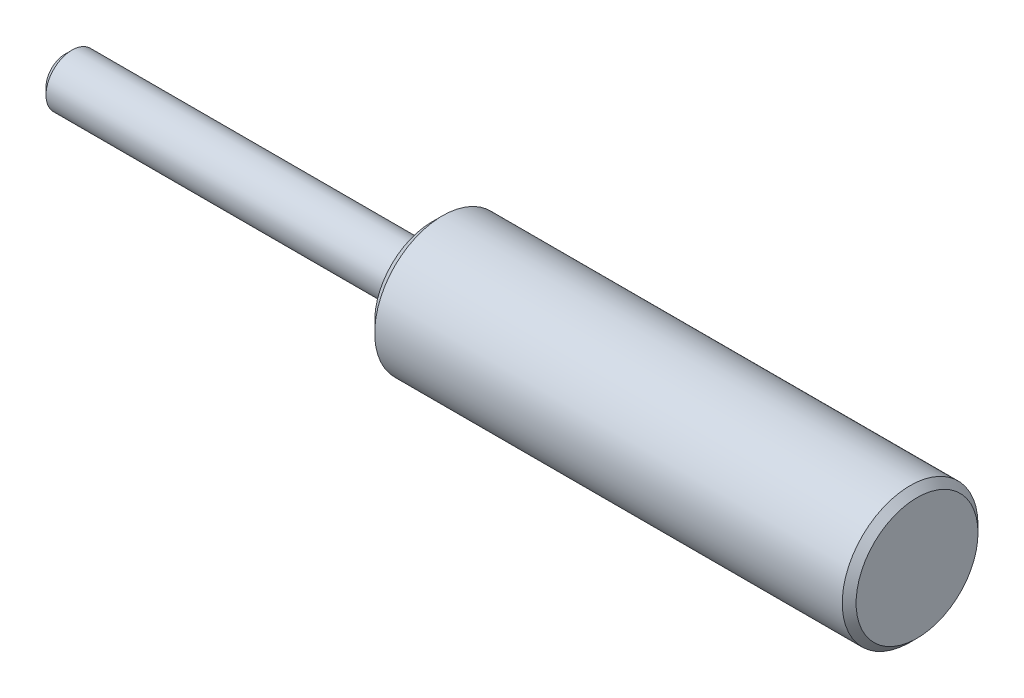
from build123d import *

# Parameters (mm, degrees)
SKETCH_1_R      = 9.8
EXTRUDE_1_DEPTH = 70
SKETCH_2_R      = 3.75
EXTRUDE_2_DEPTH = 53
CHAMFER_1_SIZE  = 1.5
CHAMFER_2_SIZE  = 1
CHAMFER_3_SIZE  = 1


with BuildPart() as part:
    # 草图1 → 凸台-拉伸1 (new body)
    with BuildSketch(Plane(origin=(0, 0, 0), x_dir=(0, 0, -1), z_dir=(1, 0, 0))):
        Circle(SKETCH_1_R)
    extrude(amount=EXTRUDE_1_DEPTH)

    # 草图2 → 凸台-拉伸2 (add)
    with BuildSketch(Plane.ZY):
        Circle(SKETCH_2_R)
    extrude(amount=EXTRUDE_2_DEPTH)

    # 倒角1
    chamfer_1_edges = [part.edges().sort_by_distance(p)[0] for p in [
        (0, 0, 9.8),
    ]]
    chamfer(chamfer_1_edges, length=CHAMFER_1_SIZE)

    # 倒角2
    chamfer_2_edges = [part.edges().sort_by_distance(p)[0] for p in [
        (-53, 0, -3.75),
    ]]
    chamfer(chamfer_2_edges, length=CHAMFER_2_SIZE)

    # 倒角3
    chamfer_3_edges = [part.edges().sort_by_distance(p)[0] for p in [
        (70, 0, 9.8),
    ]]
    chamfer(chamfer_3_edges, length=CHAMFER_3_SIZE)


solid = part.part
